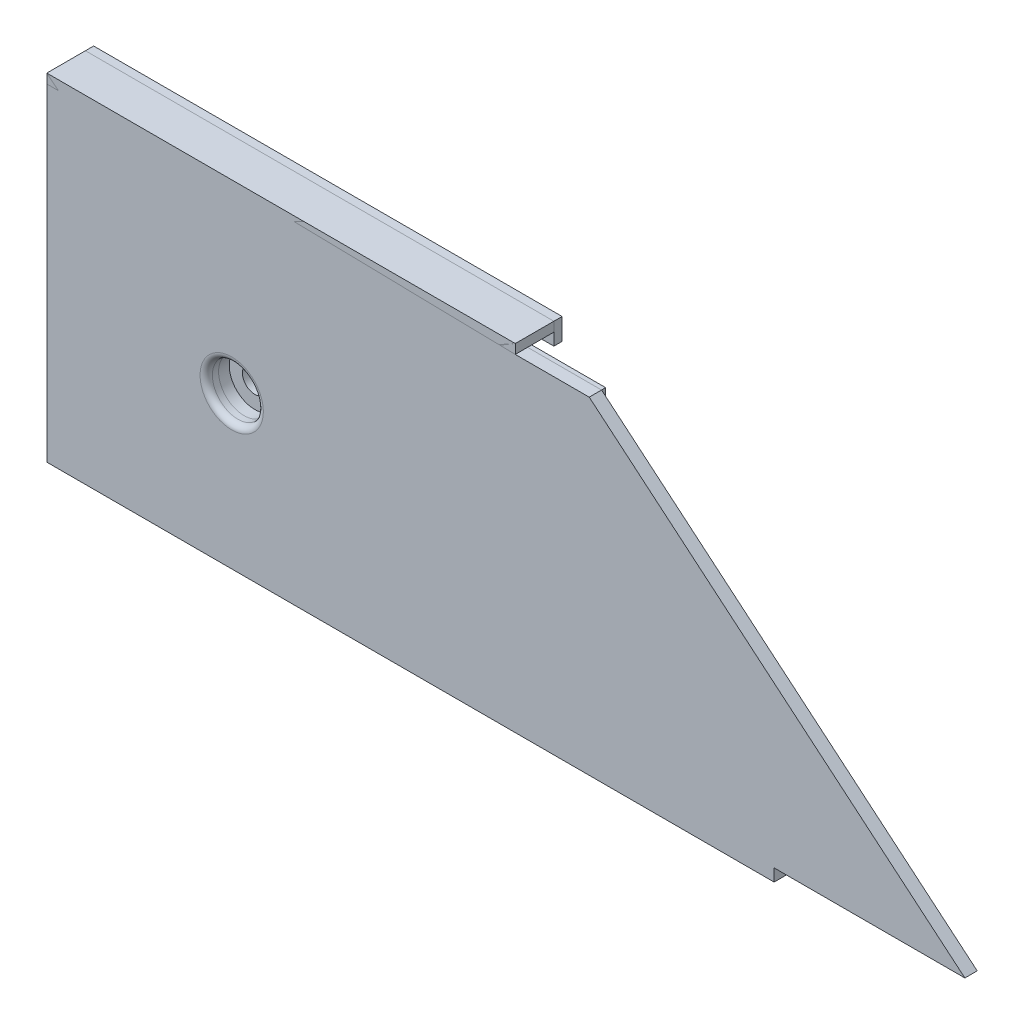
from build123d import *

# Parameters (mm, degrees)
SKETCH_2_R          = 3.1
EXTRUDE_11_DEPTH    = 1.5
SKETCH_6_R          = 3.4
EXTRUDE_12_DEPTH    = 3
SKETCH_7_W          = 57
SKETCH_7_H          = 1.149066665
EXTRUDE_13_DEPTH    = 4.7
SKETCH_10_W         = 8.999999995
SKETCH_10_H         = 1.5
EXTRUDE_15_DEPTH    = 0.5
SKETCH_11_W         = 57
SKETCH_11_H         = 2.63042276
EXTRUDE_17_DEPTH    = 1
SKETCH_13_R         = 1.5
CUT_EXTRUDE_1_DEPTH = 3
CUT_EXTRUDE_START   = -2.8
SKETCH_14_R         = 3.1
CUT_EXTRUDE_2_DEPTH = 2.8
FILLET_1_R          = 0.75


with BuildPart() as part:
    # Эскиз2 → Бобышка-Вытянуть11 (new body)
    with BuildSketch(Plane.XY):
        Polygon((-13.66679287, 0), (-13.66679287, 1.5), (9.54557674, 1.5), (-36.161548345, 39.852831801), (-45.16154834, 39.852831801), (-45.16154834, 41.001898466), (-100.16154834, 41.001898466), (-102.16154834, 41.001898466), (-102.16154834, 0), (-99.16154834, 0), align=None)
        with Locations((-79.66154834, 18.5)):
            Circle(SKETCH_2_R, mode=Mode.SUBTRACT)
    extrude(amount=EXTRUDE_11_DEPTH)

    # Скругление1
    fillet_1_edges = [part.edges().sort_by_distance(p)[0] for p in [
        (-82.76154834, 18.5, 1.5),
    ]]
    fillet(fillet_1_edges, radius=FILLET_1_R)


with BuildPart() as body_2:
    # Эскиз6 → Бобышка-Вытянуть12 (new body)
    with BuildSketch(Plane(origin=(0, 0, 0), x_dir=(-1, 0, 0), z_dir=(0, 0, -1))):
        with Locations((79.66154834, 18.5)):
            Circle(SKETCH_6_R)
    extrude(amount=EXTRUDE_12_DEPTH)

    # Эскиз13 → Вырез-Вытянуть1 (cut)
    with BuildSketch(Plane.XY):
        with Locations((-79.66154834, 18.5)):
            Circle(SKETCH_13_R)
    extrude(amount=-CUT_EXTRUDE_1_DEPTH, mode=Mode.SUBTRACT)

    # Эскиз14 → Вырез-Вытянуть2 (cut)
    with BuildSketch(Plane.XY.offset(1.5).offset(CUT_EXTRUDE_START)):
        with Locations((-79.66154834, 18.5)):
            Circle(SKETCH_14_R)
    extrude(amount=CUT_EXTRUDE_2_DEPTH, mode=Mode.SUBTRACT)


with BuildPart() as body_3:
    # Эскиз7 → Бобышка-Вытянуть13 (new body)
    with BuildSketch(Plane.XY.offset(1.5)):
        with Locations((-73.66154834, 40.427365134)):
            Rectangle(SKETCH_7_W, SKETCH_7_H)
    extrude(amount=-EXTRUDE_13_DEPTH)


with BuildPart() as body_4:
    # Эскиз10 → Бобышка-Вытянуть15 (new body)
    with BuildSketch(Plane(origin=(0, 0, 0), x_dir=(-1, 0, 0), z_dir=(0, 0, -1))):
        with Locations((40.661548342, 39.102831801)):
            Rectangle(SKETCH_10_W, SKETCH_10_H)
    extrude(amount=EXTRUDE_15_DEPTH)


with BuildPart() as body_5:
    # Эскиз11 → Бобышка-Вытянуть17 (new body)
    with BuildSketch(Plane(origin=(0, 0, -3.2), x_dir=(-1, 0, 0), z_dir=(0, 0, -1))):
        with Locations((73.66154834, 39.686687086)):
            Rectangle(SKETCH_11_W, SKETCH_11_H)
    extrude(amount=EXTRUDE_17_DEPTH)


solid = Compound([part.part, body_2.part, body_3.part, body_4.part, body_5.part])
